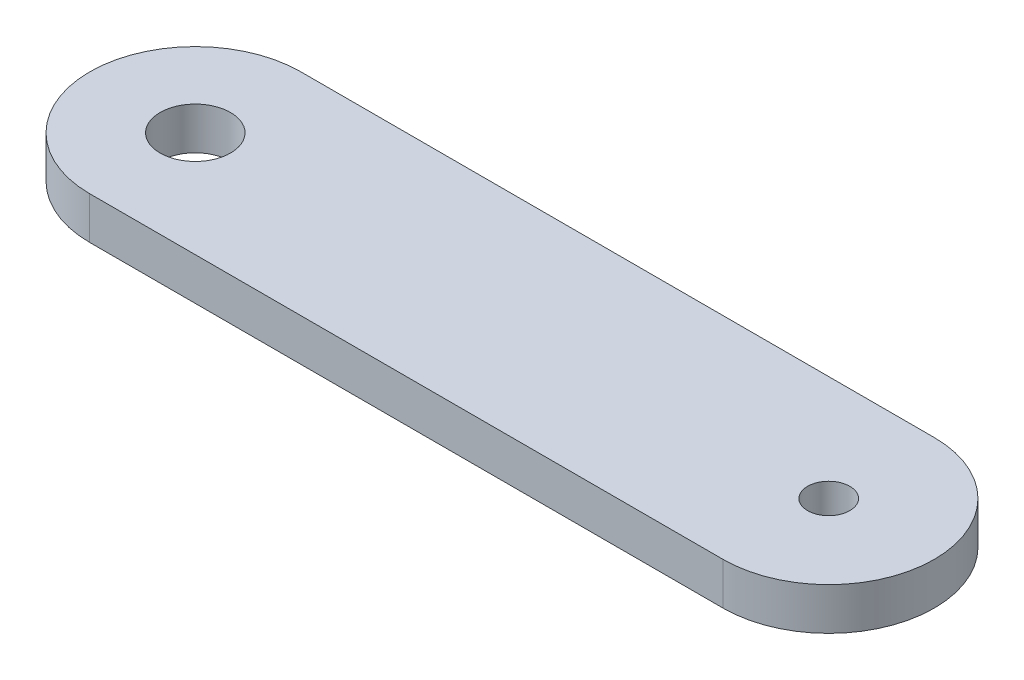
from build123d import *

# Parameters (mm, degrees)
SKETCH2_R           = 5
SKETCH2_R_2         = 3
BOSS_EXTRUDE1_DEPTH = 6


with BuildPart() as part:
    # Sketch2 → Boss-Extrude1 (new body)
    with BuildSketch(Plane(origin=(0, 0, 0), x_dir=(1, 0, 0), z_dir=(0, 1, 0))):
        with BuildLine():
            Line((-45, 15), (45, 15))
            ThreePointArc((45, 15), (60, 0), (45, -15))
            Line((45, -15), (-45, -15))
            ThreePointArc((-45, -15), (-60, 0), (-45, 15))
        make_face()
        with Locations(Location((-45, 0, 0), (0, 0, 270))):
            Circle(SKETCH2_R, mode=Mode.SUBTRACT)
        with Locations(Location((45, 0, 0), (0, 0, 270))):
            Circle(SKETCH2_R_2, mode=Mode.SUBTRACT)
    extrude(amount=BOSS_EXTRUDE1_DEPTH)


solid = part.part
